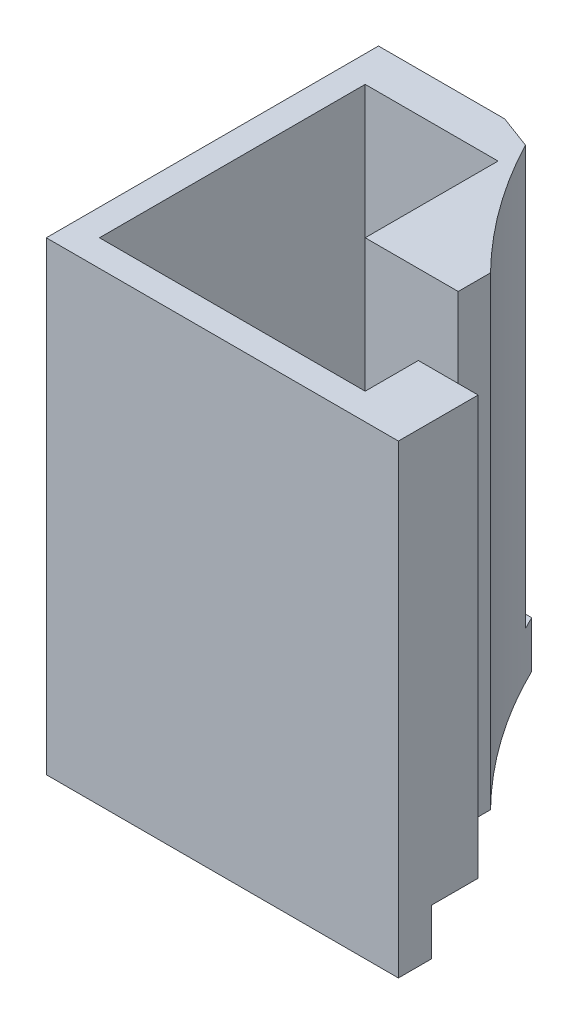
from build123d import *
from build123d.topology import SkipClean

# Parameters (mm, degrees)
SKETCH_1_W          = 50
SKETCH_1_H          = 50
EXTRUDE_1_DEPTH     = 7
SKETCH_2_R          = 80
CUT_EXTRUDE_1_DEPTH = 10
SKETCH_3_W          = 22
SKETCH_3_H          = 30
CUT_EXTRUDE_2_DEPTH = 10
HOLE_WIZARD_1_D     = 3.5
HOLE_WIZARD_2_D     = 7
HOLE_WIZARD_2_DEPTH = 4
EXTRUDE_START       = 63
SKETCH_9_W          = 15
SKETCH_9_H          = 6
SKETCH_9_W_2        = 46
SKETCH_9_H_2        = 4
EXTRUDE_2_DEPTH     = 63
SKETCH_10_W         = 6
SKETCH_10_H         = 8
EXTRUDE_3_DEPTH     = 63
SKETCH_11_W         = 5
SKETCH_11_H         = 1.5
EXTRUDE_4_DEPTH     = 7
EXTRUDE_5_DEPTH     = 3
SKETCH_13_W         = 6
SKETCH_13_H         = 1.5
EXTRUDE_6_DEPTH     = 7
EXTRUDE_7_DEPTH     = 63


with BuildPart() as part:
    # 草图1 → 凸台-拉伸1 (new body)
    with BuildSketch(Plane(origin=(0, 0, 0), x_dir=(1, 0, 0), z_dir=(0, 1, 0))):
        with Locations((25, 25)):
            Rectangle(SKETCH_1_W, SKETCH_1_H)
    extrude(amount=EXTRUDE_1_DEPTH)

    # 草图2 → 切除-拉伸1 (cut)
    with BuildSketch(Plane(origin=(0, 7, 0), x_dir=(1, 0, 0), z_dir=(0, 1, 0))):
        with Locations((95, 85)):
            Circle(SKETCH_2_R)
    extrude(amount=-CUT_EXTRUDE_1_DEPTH, mode=Mode.SUBTRACT)

    # 草图3 → 切除-拉伸2 (cut)
    with BuildSketch(Plane(origin=(0, 7, 0), x_dir=(1, 0, 0), z_dir=(0, 1, 0))):
        with Locations((49, 20)):
            Rectangle(SKETCH_3_W, SKETCH_3_H)
    extrude(amount=-CUT_EXTRUDE_2_DEPTH, mode=Mode.SUBTRACT)

    # 孔1 (through all)
    with Locations(Plane(origin=(0, 0, 0), x_dir=(-1, 0, 0), z_dir=(0, -1, 0))):
        with Locations((-32, 8), (-8, 8)):
            Hole(HOLE_WIZARD_1_D / 2)

    # 孔2
    with Locations(Plane(origin=(0, 7, 0), x_dir=(1, 0, 0), z_dir=(0, 1, 0))):
        with Locations((8, 8), (32, 8)):
            Hole(HOLE_WIZARD_2_D / 2, depth=HOLE_WIZARD_2_DEPTH)

    # 草图9 → 凸台-拉伸2 (add)
    with SkipClean():  # the faces are left unmerged after this step: merging them gives an invalid solid
        with BuildSketch(Plane(origin=(0, 7, 0), x_dir=(1, 0, 0), z_dir=(0, 1, 0)).offset(EXTRUDE_START)):
            with Locations((11.5, 47)):
                Rectangle(SKETCH_9_W, SKETCH_9_H)
            Polygon((0, 50), (0, 0), (4, 0), (4, 4), (4, 44), (4, 50), align=None)
            with Locations((27, 2)):
                Rectangle(SKETCH_9_W_2, SKETCH_9_H_2)
            with BuildLine():
                ThreePointArc((38, 28.866231197), (30.278867045, 37.976867938), (24, 48.135382818))
                Line((24, 48.135382818), (24, 24))
                Line((24, 24), (38, 24))
                Line((38, 24), (38, 28.866231197))
            make_face()
        extrude(amount=-EXTRUDE_2_DEPTH)

    # 草图10 → 凸台-拉伸3 (add)
    with SkipClean():  # the faces are left unmerged after this step: merging them gives an invalid solid
        with BuildSketch(Plane(origin=(0, 7, 0), x_dir=(1, 0, 0), z_dir=(0, 1, 0))):
            with Locations((47, 8)):
                Rectangle(SKETCH_10_W, SKETCH_10_H)
        extrude(amount=EXTRUDE_3_DEPTH)

    # 草图11 → 凸台-拉伸4 (add)
    with SkipClean():  # the faces are left unmerged after this step: merging them gives an invalid solid
        with BuildSketch(Plane.XZ.offset(-7)):
            with Locations((46.5, -5.75)):
                Rectangle(SKETCH_11_W, SKETCH_11_H)
        extrude(amount=EXTRUDE_4_DEPTH)

    # 草图12 → 凸台-拉伸5 (add)
    with SkipClean():  # the faces are left unmerged after this step: merging them gives an invalid solid
        with BuildSketch(Plane(origin=(50, 0, 0), x_dir=(0, 0, -1), z_dir=(1, 0, 0))):
            Polygon((5, 7), (12, 7), (12, 70), (0, 70), (0, 0), (5, 0), align=None)
        extrude(amount=EXTRUDE_5_DEPTH)

    # 草图13 → 凸台-拉伸6 (add)
    with SkipClean():  # the faces are left unmerged after this step: merging them gives an invalid solid
        with BuildSketch(Plane(origin=(0, 0, 0), x_dir=(-1, 0, 0), z_dir=(0, -1, 0))):
            with Locations((-41, 5.75)):
                Rectangle(SKETCH_13_W, SKETCH_13_H)
        extrude(amount=-EXTRUDE_6_DEPTH)

    # 草图15 → 凸台-拉伸7 (add)
    with SkipClean():  # the faces are left unmerged after this step: merging them gives an invalid solid
        with BuildSketch(Plane(origin=(0, 7, 0), x_dir=(1, 0, 0), z_dir=(0, 1, 0))):
            Polygon((19, 44), (24, 44), (24, 48.135382818), (19, 50), align=None)
        extrude(amount=EXTRUDE_7_DEPTH)


solid = part.part
